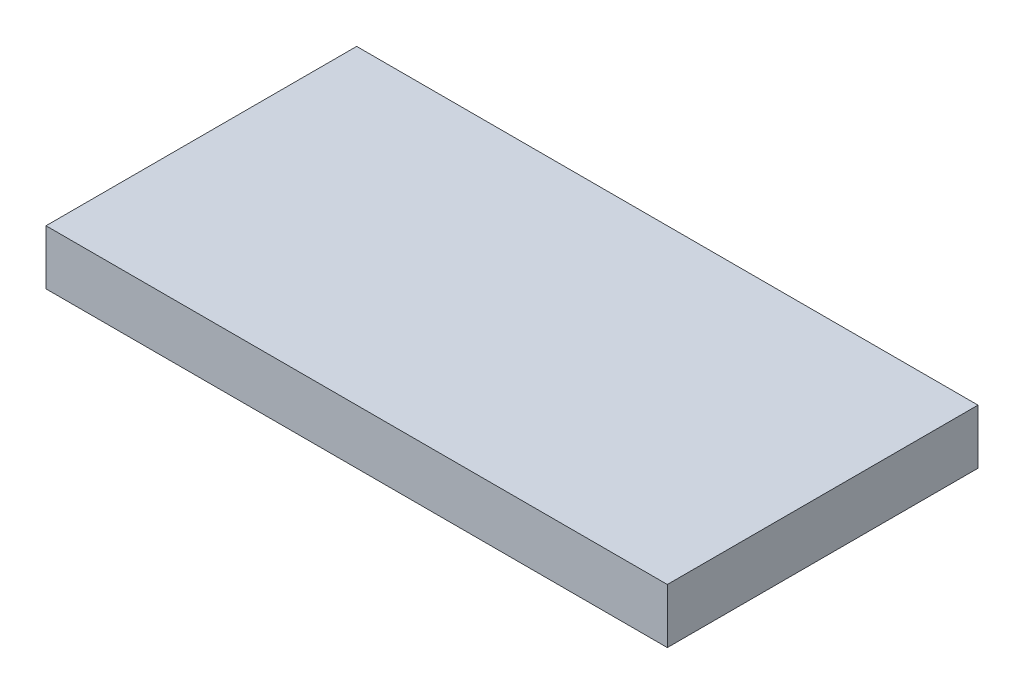
from build123d import *

# Parameters (mm, degrees)
SKETCH_1_W      = 25
SKETCH_1_H      = 12.5
EXTRUDE_1_DEPTH = 2.2


with BuildPart() as part:
    # Эскиз1 → Бобышка-Вытянуть1 (new body)
    with BuildSketch(Plane(origin=(0, 0, 0), x_dir=(1, 0, 0), z_dir=(0, 1, 0))):
        with Locations((12.5, -6.25)):
            Rectangle(SKETCH_1_W, SKETCH_1_H)
    extrude(amount=EXTRUDE_1_DEPTH)


solid = part.part
